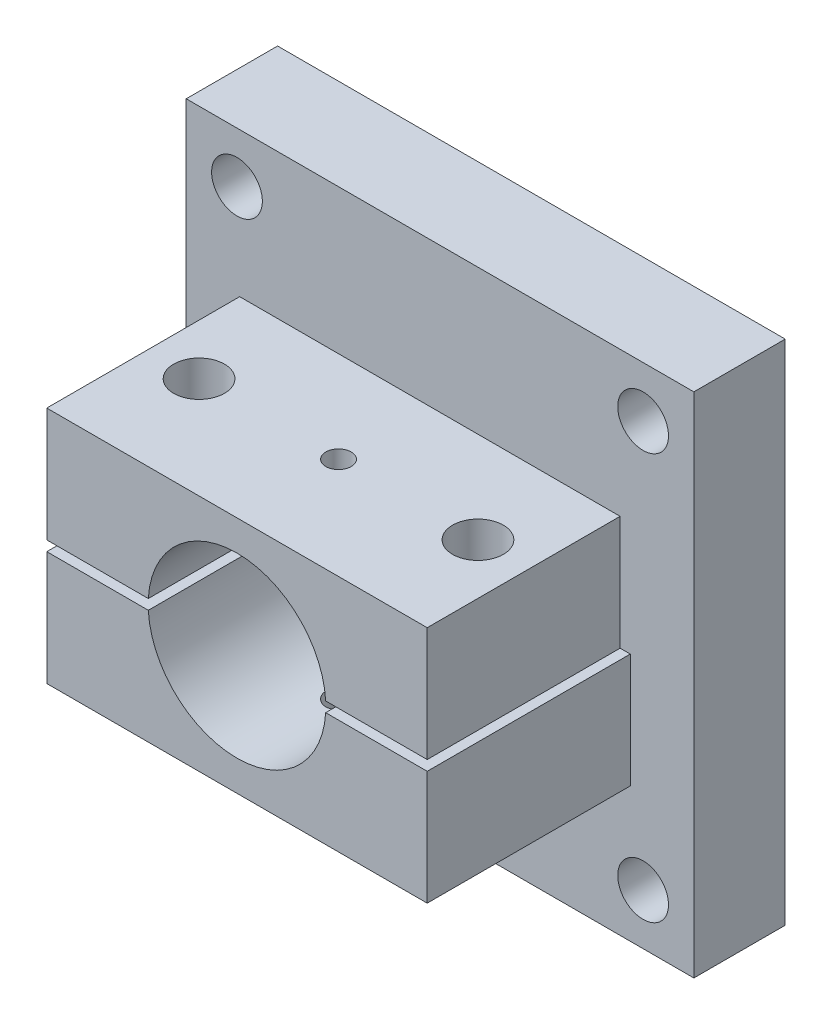
from build123d import *

# Parameters (mm, degrees)
SKETCH1_R               = 3.175
BOSS_EXTRUDE1_DEPTH     = 6.35
BOSS_EXTRUDE2_START     = 6.35
BOSS_EXTRUDE2_DEPTH     = 25.4
BOSS_EXTRUDE3_START     = 31.75
BOSS_EXTRUDE3_DEPTH     = 24.13
CUT_EXTRUDE1_DEPTH      = 55.99261314
CUT_EXTRUDE1_DEPTH_BACK = 55.99261314
SKETCH2_R               = 3.175
SKETCH2_R_2             = 1.5875
BOSS_EXTRUDE4_START     = -5.08
SKETCH1_5_R             = 3.175
SKETCH1_5_R_2           = 11.1125
BOSS_EXTRUDE4_DEPTH     = 5.08


with BuildPart() as part:
    # Sketch1 → Boss-Extrude1 (new body)
    # profile 1 of 3: a face of its own
    with BuildSketch(Plane.XY):
        Polygon((31.75, 31.75), (-31.75, 31.75), (-31.75, 0), (-31.75, -0.635), (-31.75, -31.75), (31.75, -31.75), align=None)
        with Locations((-25.4, -25.4)):
            Circle(SKETCH1_R, mode=Mode.SUBTRACT)
        with Locations((25.4, -25.4)):
            Circle(SKETCH1_R, mode=Mode.SUBTRACT)
        with Locations((-25.4, 25.4)):
            Circle(SKETCH1_R, mode=Mode.SUBTRACT)
        with BuildLine():
            Line((-23.794342308, -0.635), (-11.094342308, -0.635))
            ThreePointArc((-11.094342308, -0.635), (-11.1125, 0), (-11.094342308, 0.635))
            Line((-11.094342308, 0.635), (-23.794342308, 0.635))
            Line((-23.794342308, 0.635), (-23.794342308, 14.9225))
            Line((-23.794342308, 14.9225), (23.794342308, 14.9225))
            Line((23.794342308, 14.9225), (23.794342308, 0.635))
            Line((23.794342308, 0.635), (11.094342308, 0.635))
            ThreePointArc((11.094342308, 0.635), (11.107959649, 0.317629777), (11.1125, 0))
            ThreePointArc((11.1125, 0), (11.107959649, -0.317629777), (11.094342308, -0.635))
            Line((11.094342308, -0.635), (23.794342308, -0.635))
            Line((23.794342308, -0.635), (23.794342308, -14.9225))
            Line((23.794342308, -14.9225), (-23.794342308, -14.9225))
            Line((-23.794342308, -14.9225), (-23.794342308, -0.635))
        make_face(mode=Mode.SUBTRACT)
        with Locations((25.4, 25.4)):
            Circle(SKETCH1_R, mode=Mode.SUBTRACT)
    # profile 2 of 3: a face of its own
    with BuildSketch(Plane.XY):
        with BuildLine():
            Line((-23.794342308, 0.635), (-11.094342308, 0.635))
            ThreePointArc((-11.094342308, 0.635), (0, 11.1125), (11.094342308, 0.635))
            Line((11.094342308, 0.635), (23.794342308, 0.635))
            Line((23.794342308, 0.635), (23.794342308, 14.9225))
            Line((23.794342308, 14.9225), (-23.794342308, 14.9225))
            Line((-23.794342308, 14.9225), (-23.794342308, 0.635))
        make_face()
    # profile 3 of 3: a face of its own
    with BuildSketch(Plane.XY):
        with BuildLine():
            ThreePointArc((11.094342308, -0.635), (0, -11.1125), (-11.094342308, -0.635))
            Line((-11.094342308, -0.635), (-23.794342308, -0.635))
            Line((-23.794342308, -0.635), (-23.794342308, -14.9225))
            Line((-23.794342308, -14.9225), (23.794342308, -14.9225))
            Line((23.794342308, -14.9225), (23.794342308, -0.635))
            Line((23.794342308, -0.635), (11.094342308, -0.635))
        make_face()
    extrude(amount=BOSS_EXTRUDE1_DEPTH)

    # Sketch1<3> → Boss-Extrude2 (add)
    with BuildSketch(Plane.XY.offset(BOSS_EXTRUDE2_START)):
        with BuildLine():
            ThreePointArc((11.094342308, -0.635), (0, -11.1125), (-11.094342308, -0.635))
            Line((-11.094342308, -0.635), (-23.794342308, -0.635))
            Line((-23.794342308, -0.635), (-23.794342308, -14.9225))
            Line((-23.794342308, -14.9225), (23.794342308, -14.9225))
            Line((23.794342308, -14.9225), (23.794342308, -0.635))
            Line((23.794342308, -0.635), (11.094342308, -0.635))
        make_face()
    extrude(amount=BOSS_EXTRUDE2_DEPTH)


with BuildPart() as body_2:
    # Sketch1<4> → Boss-Extrude3 (new body)
    with BuildSketch(Plane.XY.offset(BOSS_EXTRUDE3_START)):
        with BuildLine():
            Line((-23.794342308, 0.635), (-11.094342308, 0.635))
            ThreePointArc((-11.094342308, 0.635), (0, 11.1125), (11.094342308, 0.635))
            Line((11.094342308, 0.635), (23.794342308, 0.635))
            Line((23.794342308, 0.635), (23.794342308, 14.9225))
            Line((23.794342308, 14.9225), (-23.794342308, 14.9225))
            Line((-23.794342308, 14.9225), (-23.794342308, 0.635))
        make_face()
    extrude(amount=-BOSS_EXTRUDE3_DEPTH)


with BuildPart() as cut_extrude1_tool:
    # Sketch2 → Cut-Extrude1 (new, two sides: drawn at the far end of the back side and taken through both)
    with BuildSketch(Plane(origin=(0, 0, 0), x_dir=(1, 0, 0), z_dir=(0, 1, 0)).offset(-CUT_EXTRUDE1_DEPTH_BACK)):
        with Locations(Location((17.444342308, -19.05, 0), (0, 0, 270))):
            Circle(SKETCH2_R)
        with Locations(Location((-17.444342308, -19.05, 0), (0, 0, 270))):
            Circle(SKETCH2_R)
        with Locations(Location((0, -19.05, 0), (0, 0, 270))):
            Circle(SKETCH2_R_2)
    extrude(amount=CUT_EXTRUDE1_DEPTH + CUT_EXTRUDE1_DEPTH_BACK)


with BuildPart() as part_1:
    add(part.part)

    # Cut-Extrude1: cut by cut_extrude1_tool
    add(cut_extrude1_tool.part, mode=Mode.SUBTRACT)

    # Sketch1<5> → Boss-Extrude4 (add)
    # profile 1 of 4: a face of its own
    with BuildSketch(Plane.XY.offset(BOSS_EXTRUDE4_START)):
        Polygon((31.75, 31.75), (-31.75, 31.75), (-31.75, 0), (-31.75, -0.635), (-31.75, -31.75), (31.75, -31.75), align=None)
        with Locations((-25.4, -25.4)):
            Circle(SKETCH1_5_R, mode=Mode.SUBTRACT)
        with Locations((25.4, -25.4)):
            Circle(SKETCH1_5_R, mode=Mode.SUBTRACT)
        with Locations((-25.4, 25.4)):
            Circle(SKETCH1_5_R, mode=Mode.SUBTRACT)
        with BuildLine():
            Line((-23.794342308, -0.635), (-11.094342308, -0.635))
            ThreePointArc((-11.094342308, -0.635), (-11.1125, 0), (-11.094342308, 0.635))
            Line((-11.094342308, 0.635), (-23.794342308, 0.635))
            Line((-23.794342308, 0.635), (-23.794342308, 14.9225))
            Line((-23.794342308, 14.9225), (23.794342308, 14.9225))
            Line((23.794342308, 14.9225), (23.794342308, 0.635))
            Line((23.794342308, 0.635), (11.094342308, 0.635))
            ThreePointArc((11.094342308, 0.635), (11.107959649, 0.317629777), (11.1125, 0))
            ThreePointArc((11.1125, 0), (11.107959649, -0.317629777), (11.094342308, -0.635))
            Line((11.094342308, -0.635), (23.794342308, -0.635))
            Line((23.794342308, -0.635), (23.794342308, -14.9225))
            Line((23.794342308, -14.9225), (-23.794342308, -14.9225))
            Line((-23.794342308, -14.9225), (-23.794342308, -0.635))
        make_face(mode=Mode.SUBTRACT)
        with Locations((25.4, 25.4)):
            Circle(SKETCH1_5_R, mode=Mode.SUBTRACT)
    # profile 2 of 4: a face of its own
    with BuildSketch(Plane.XY.offset(BOSS_EXTRUDE4_START)):
        with BuildLine():
            Line((-23.794342308, 0.635), (-11.094342308, 0.635))
            ThreePointArc((-11.094342308, 0.635), (0, 11.1125), (11.094342308, 0.635))
            Line((11.094342308, 0.635), (23.794342308, 0.635))
            Line((23.794342308, 0.635), (23.794342308, 14.9225))
            Line((23.794342308, 14.9225), (-23.794342308, 14.9225))
            Line((-23.794342308, 14.9225), (-23.794342308, 0.635))
        make_face()
    # profile 3 of 4: a face of its own
    with BuildSketch(Plane.XY.offset(BOSS_EXTRUDE4_START)):
        with Locations(Location((0, 0, 0), (0, 0, 183.27582896))):
            Circle(SKETCH1_5_R_2)
    # profile 4 of 4: a face of its own
    with BuildSketch(Plane.XY.offset(BOSS_EXTRUDE4_START)):
        with BuildLine():
            ThreePointArc((11.094342308, -0.635), (0, -11.1125), (-11.094342308, -0.635))
            Line((-11.094342308, -0.635), (-23.794342308, -0.635))
            Line((-23.794342308, -0.635), (-23.794342308, -14.9225))
            Line((-23.794342308, -14.9225), (23.794342308, -14.9225))
            Line((23.794342308, -14.9225), (23.794342308, -0.635))
            Line((23.794342308, -0.635), (11.094342308, -0.635))
        make_face()
    extrude(amount=BOSS_EXTRUDE4_DEPTH)


with BuildPart() as body_2_1:
    add(body_2.part)

    # Cut-Extrude1: cut by cut_extrude1_tool
    add(cut_extrude1_tool.part, mode=Mode.SUBTRACT)


solid = Compound([part_1.part, body_2_1.part])
